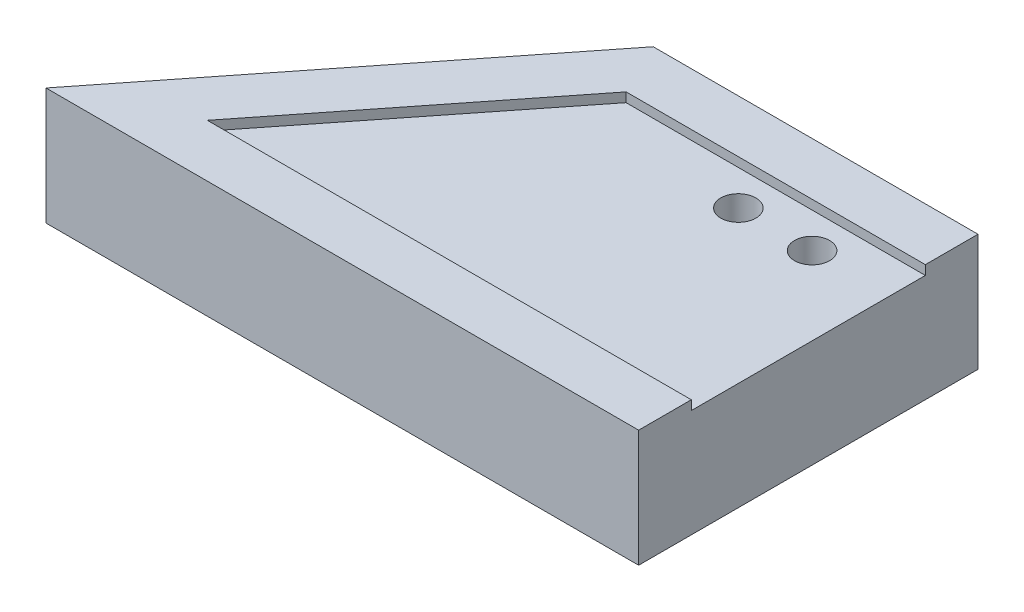
from build123d import *

# Parameters (mm, degrees)
BOSS_EXTRUDE1_DEPTH = 10
CUT_EXTRUDE1_START  = -10
SKETCH2_R           = 1.5
CUT_EXTRUDE1_DEPTH  = 0.8
CUT_EXTRUDE2_START  = -15
SKETCH2_3_R         = 1.5
CUT_EXTRUDE2_DEPTH  = 15
CUT_EXTRUDE3_DEPTH  = 76.909294374


with BuildPart() as part:
    # Sketch1 → Boss-Extrude1 (new body)
    # profile 1 of 2: a face of its own
    with BuildSketch(Plane(origin=(0, 0, 0), x_dir=(1, 0, 0), z_dir=(0, 1, 0))):
        Polygon((71.317746546, -5), (48.423009704, 24), (12.576990296, 24), (-10.317746546, -5), align=None)
        Polygon((15, 19), (0, 0), (61, 0), (46, 19), align=None, mode=Mode.SUBTRACT)
    # profile 2 of 2: a face of its own
    with BuildSketch(Plane(origin=(0, 0, 0), x_dir=(1, 0, 0), z_dir=(0, 1, 0))):
        Polygon((46, 19), (15, 19), (0, 0), (61, 0), align=None)
    extrude(amount=BOSS_EXTRUDE1_DEPTH)

    # Sketch2 → Cut-Extrude1 (cut)
    with BuildSketch(Plane.XZ.offset(CUT_EXTRUDE1_START)):
        Polygon((14.75769903, -19.5), (46.24230097, -19.5), (62.031774655, 0.5), (-1.031774655, 0.5), align=None)
        with Locations(Location((27.35, -16.5, 0), (0, 0, 90))):
            Circle(SKETCH2_R, mode=Mode.SUBTRACT)
        with Locations(Location((33.65, -16.5, 0), (0, 0, 90))):
            Circle(SKETCH2_R, mode=Mode.SUBTRACT)
    extrude(amount=CUT_EXTRUDE1_DEPTH, mode=Mode.SUBTRACT)

    # Sketch2<3> → Cut-Extrude2 (cut)
    with BuildSketch(Plane.XZ.offset(CUT_EXTRUDE2_START)):
        with Locations(Location((27.35, -16.5, 0), (0, 0, 270))):
            Circle(SKETCH2_3_R)
        with Locations(Location((33.65, -16.5, 0), (0, 0, 270))):
            Circle(SKETCH2_3_R)
    extrude(amount=CUT_EXTRUDE2_DEPTH, mode=Mode.SUBTRACT)

    # Sketch3 → Cut-Extrude3 (cut, through all)
    with BuildSketch(Plane.XZ):
        Polygon((40.330212267, 5), (40.330212267, -24), (48.423009704, -24), (71.317746546, 5), align=None)
    extrude(amount=-CUT_EXTRUDE3_DEPTH, mode=Mode.SUBTRACT)


solid = part.part
